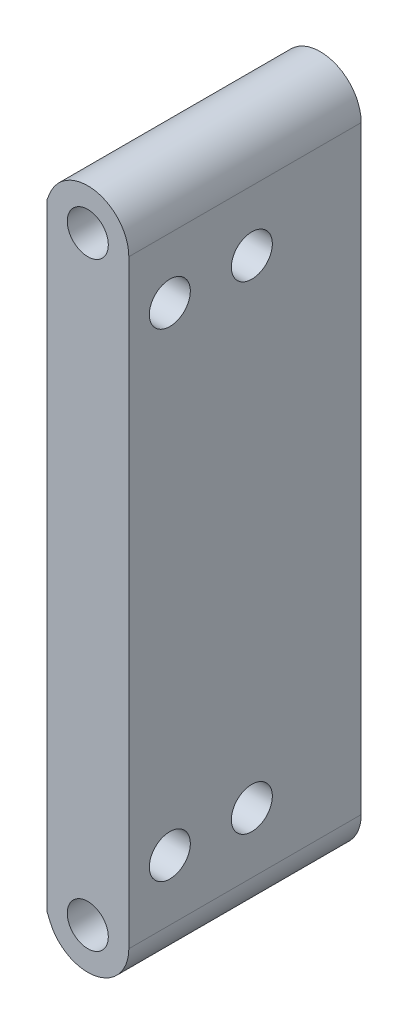
from build123d import *

# Parameters (mm, degrees)
SKETCH_1_R          = 1.5
EXTRUDE_1_DEPTH     = 17
SKETCH_3_W          = 9.079689783
SKETCH_3_H          = 45.034094638
CUT_EXTRUDE_2_DEPTH = 12
SKETCH_5_R          = 1.5
CUT_EXTRUDE_3_DEPTH = 32.503374865


with BuildPart() as part:
    # 草图1 → 凸台-拉伸1 (new body)
    with BuildSketch(Plane.XY):
        with BuildLine():
            Line((-24.691948814, 23.068360514), (-33.771638598, 1.148050297))
            ThreePointArc((-33.771638598, 1.148050297), (-34, 0), (-33.771638598, -1.148050297))
            Line((-33.771638598, -1.148050297), (-24.691948814, -23.068360514))
            ThreePointArc((-24.691948814, -23.068360514), (-21.335039251, -24.862666058), (-18.920310217, -21.920310217))
            Line((-18.920310217, -21.920310217), (-18.920310217, 21.920310217))
            ThreePointArc((-18.920310217, 21.920310217), (-21.335039251, 24.862666058), (-24.691948814, 23.068360514))
        make_face()
        with Locations((-31, 0)):
            Circle(SKETCH_1_R, mode=Mode.SUBTRACT)
        with Locations((-21.920310217, 21.920310217)):
            Circle(SKETCH_1_R, mode=Mode.SUBTRACT)
        with Locations((-21.920310217, -21.920310217)):
            Circle(SKETCH_1_R, mode=Mode.SUBTRACT)
    extrude(amount=EXTRUDE_1_DEPTH)

    # 草图3 → 切除-拉伸2 (cut)
    with BuildSketch(Plane.XY.offset(17)):
        with Locations((-29.460155109, 0)):
            Rectangle(SKETCH_3_W, SKETCH_3_H)
    extrude(amount=-CUT_EXTRUDE_2_DEPTH, mode=Mode.SUBTRACT)

    # 草图5 → 切除-拉伸3 (cut, through all)
    with BuildSketch(Plane.ZY.offset(24.920310217)):
        with Locations(Location((8, 17.5, 0), (0, 0, 270))):
            Circle(SKETCH_5_R)
        with Locations(Location((14, 17.5, 0), (0, 0, 90))):
            Circle(SKETCH_5_R)
        with Locations(Location((14, -17.5, 0), (0, 0, 270))):
            Circle(SKETCH_5_R)
        with Locations(Location((8, -17.5, 0), (0, 0, 90))):
            Circle(SKETCH_5_R)
    extrude(amount=-CUT_EXTRUDE_3_DEPTH, mode=Mode.SUBTRACT)


solid = part.part
